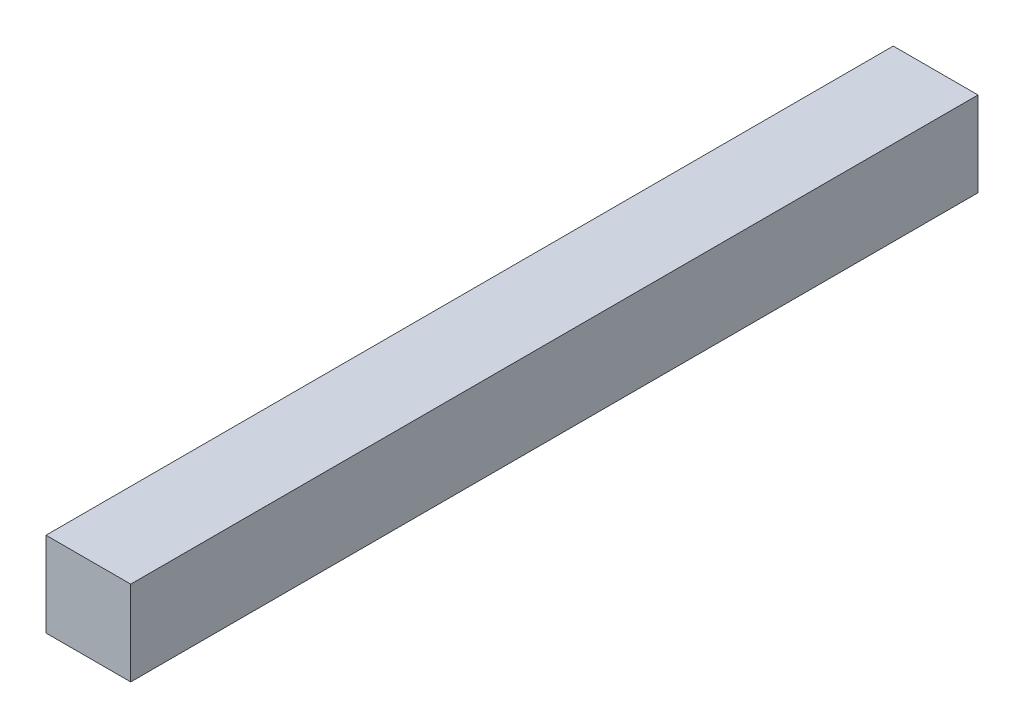
from build123d import *

# Parameters (mm, degrees)
SKETCH1_W           = 25.4
SKETCH1_H           = 25.4
BOSS_EXTRUDE1_DEPTH = 254


with BuildPart() as part:
    # Sketch1 → Boss-Extrude1 (new body)
    with BuildSketch(Plane.XY):
        with Locations((-0.866742666, -14.16441457)):
            Rectangle(SKETCH1_W, SKETCH1_H)
    extrude(amount=BOSS_EXTRUDE1_DEPTH)


solid = part.part
